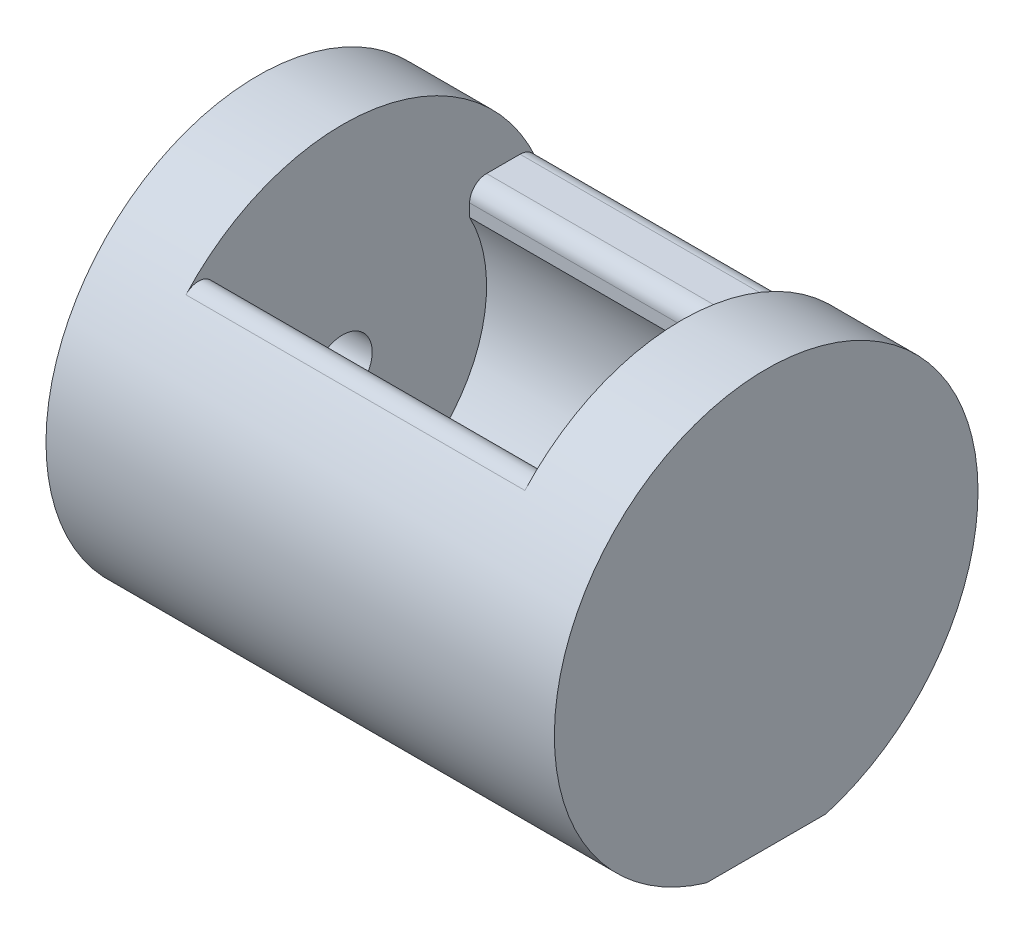
from build123d import *

# Parameters (mm, degrees)
SKETCH2_R               = 25
BOSS_EXTRUDE1_DEPTH     = 60
CUT_EXTRUDE3_DEPTH      = 30
CUT_EXTRUDE4_DEPTH      = 20
CUT_EXTRUDE4_DEPTH_BACK = 20
SKETCH5_R               = 17
FILLET3_R               = 2
SKETCH6_R               = 3.5
CUT_EXTRUDE5_DEPTH      = 20
CUT_EXTRUDE7_DEPTH      = 3
CUT_EXTRUDE8_DEPTH      = 70.641941386
SKETCH9_W               = 40
SKETCH9_H               = 6
CUT_EXTRUDE9_DEPTH      = 30
FILLET5_R               = 2


with BuildPart() as part:
    # Sketch2 → Boss-Extrude1 (new body)
    with BuildSketch(Plane(origin=(0, 0, 0), x_dir=(0, 0, -1), z_dir=(1, 0, 0))):
        Circle(SKETCH2_R)
    extrude(amount=BOSS_EXTRUDE1_DEPTH)

    # Sketch4 → Cut-Extrude3 (cut)
    with BuildSketch(Plane(origin=(0, 0, 0), x_dir=(1, 0, 0), z_dir=(0, 1, 0))):
        Polygon((10, 0), (10, 15), (50, 15), (50, -15), (10, -15), align=None)
    extrude(amount=CUT_EXTRUDE3_DEPTH, mode=Mode.SUBTRACT)

    # Sketch5 → Cut-Extrude4 (cut, two sides: drawn at the far end of the back side and taken through both)
    with BuildSketch(Plane(origin=(30, 0, 0), x_dir=(0, 0, -1), z_dir=(1, 0, 0)).offset(-CUT_EXTRUDE4_DEPTH_BACK)):
        Circle(SKETCH5_R)
    extrude(amount=CUT_EXTRUDE4_DEPTH + CUT_EXTRUDE4_DEPTH_BACK, mode=Mode.SUBTRACT)

    # Fillet3
    fillet3_edges = [part.edges().sort_by_distance(p)[0] for p in [
        (30, 20, -15),
        (30, 20, 15),
    ]]
    fillet(fillet3_edges, radius=FILLET3_R)

    # Sketch6 → Cut-Extrude5 (cut)
    with BuildSketch(Plane(origin=(0, 0, 0), x_dir=(0, 0, -1), z_dir=(1, 0, 0))):
        with Locations(Location((0, 0, 0), (0, 0, 180))):
            Circle(SKETCH6_R)
    extrude(amount=CUT_EXTRUDE5_DEPTH, mode=Mode.SUBTRACT)

    # Sketch7 → Cut-Extrude7 (cut)
    with BuildSketch(Plane(origin=(0, 0, 0), x_dir=(0, 0, -1), z_dir=(1, 0, 0))):
        with BuildLine():
            Line((-8.5, -0.449954403), (-8.5, 0))
            ThreePointArc((-8.5, 0), (0, 8.5), (8.5, 0))
            Line((8.5, 0), (8.5, -17.5))
            Line((8.5, -17.5), (-8.5, -17.5))
            Line((-8.5, -17.5), (-8.5, -0.449954403))
        make_face()
    extrude(amount=CUT_EXTRUDE7_DEPTH, mode=Mode.SUBTRACT)

    # Sketch8 → Cut-Extrude8 (cut, through all)
    with BuildSketch(Plane(origin=(0, 0, 0), x_dir=(0, 0, -1), z_dir=(1, 0, 0))):
        Polygon((0, -25), (-19.612673496, -25), (-19.612673496, -23.986231348), (13.394020924, -23.986231348), (13.394020924, -25), align=None)
    extrude(amount=CUT_EXTRUDE8_DEPTH, mode=Mode.SUBTRACT)

    # Sketch9 → Cut-Extrude9 (cut)
    with BuildSketch(Plane.XY):
        with Locations((30, 14.491933385)):
            Rectangle(SKETCH9_W, SKETCH9_H)
    extrude(amount=-CUT_EXTRUDE9_DEPTH, mode=Mode.SUBTRACT)

    # Fillet5
    fillet5_edges = [part.edges().sort_by_distance(p)[0] for p in [
        (30, 11.491933385, -15),
        (30, 11.491933385, -22.202150055),
    ]]
    fillet(fillet5_edges, radius=FILLET5_R)


solid = part.part
